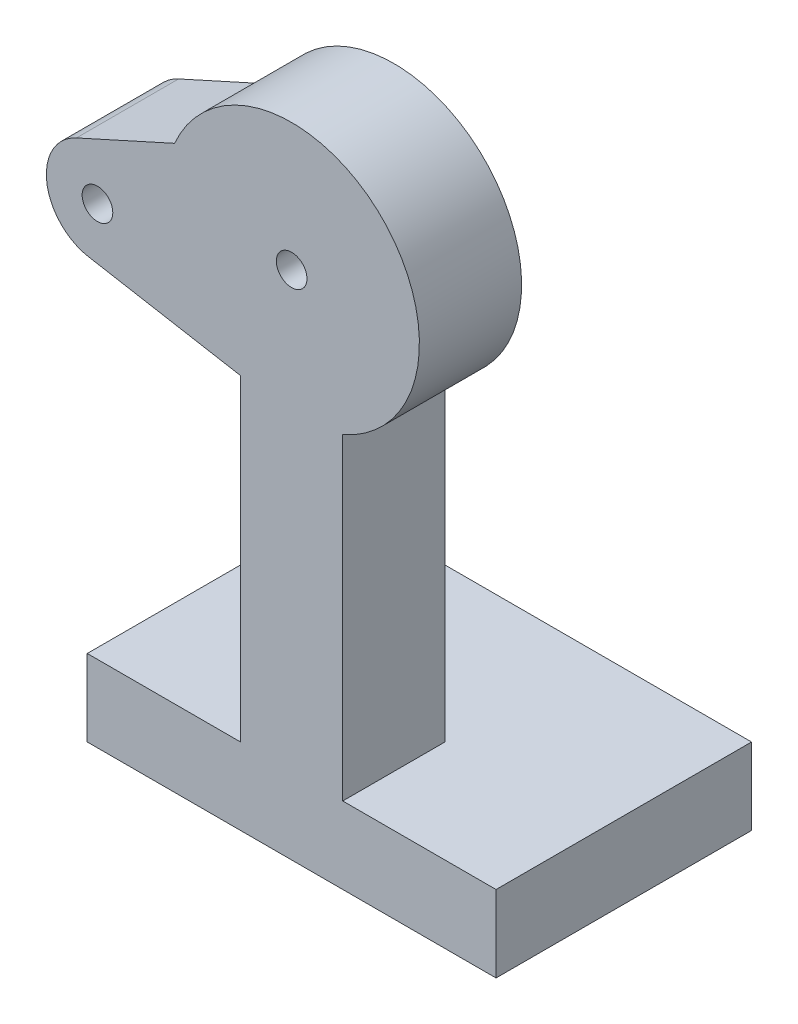
from build123d import *

# Parameters (mm, degrees)
BOSS_EXTRUDE1_DEPTH = 10
BOSS_EXTRUDE2_DEPTH = 40
SKETCH3_R           = 3
CUT_EXTRUDE1_DEPTH  = 134.814236911
SKETCH4_R           = 3
BOSS_EXTRUDE4_DEPTH = 20


with BuildPart() as part:
    # Sketch1 → Boss-Extrude1 (new, symmetric)
    with BuildSketch(Plane.XY):
        with BuildLine():
            Line((-40, 7.5), (-10, 7.5))
            Line((-10, 7.5), (-10, 69.587121525))
            ThreePointArc((-10, 69.587121525), (0, 117.5), (10, 69.587121525))
            Line((10, 69.587121525), (10, 7.5))
            Line((10, 7.5), (40, 7.5))
            Line((40, 7.5), (40, -7.5))
            Line((40, -7.5), (-40, -7.5))
            Line((-40, -7.5), (-40, 7.5))
        make_face()
    extrude(amount=BOSS_EXTRUDE1_DEPTH, both=True)

    # Sketch2 → Boss-Extrude2 (add)
    with BuildSketch(Plane(origin=(0, 0, 0), x_dir=(-1, 0, 0), z_dir=(0, 0, -1))):
        Polygon((-10, 7.5), (10, 7.5), (40, 7.5), (40, -7.5), (-40, -7.5), (-40, 7.5), align=None)
    extrude(amount=BOSS_EXTRUDE2_DEPTH)

    # Sketch3 → Cut-Extrude1 (cut, through all)
    with BuildSketch(Plane.XY.offset(10)):
        with Locations((0, 92.5)):
            Circle(SKETCH3_R)
    extrude(amount=-CUT_EXTRUDE1_DEPTH, mode=Mode.SUBTRACT)

    # Sketch4 → Boss-Extrude4 (add)
    with BuildSketch(Plane.XY.offset(10)):
        with BuildLine():
            ThreePointArc((-10, 69.587121525), (-23.272919558, 83.369216066), (-22.912878475, 102.5))
            Line((-22.912878475, 102.5), (-42.121373711, 93.811217193))
            ThreePointArc((-42.121373711, 93.811217193), (-47.922246908, 83.455405164), (-39.743371486, 74.853139797))
            Line((-39.743371486, 74.853139797), (-10, 69.587121525))
        make_face()
        with Locations((-38, 84.7)):
            Circle(SKETCH4_R, mode=Mode.SUBTRACT)
    extrude(amount=-BOSS_EXTRUDE4_DEPTH)


solid = part.part
